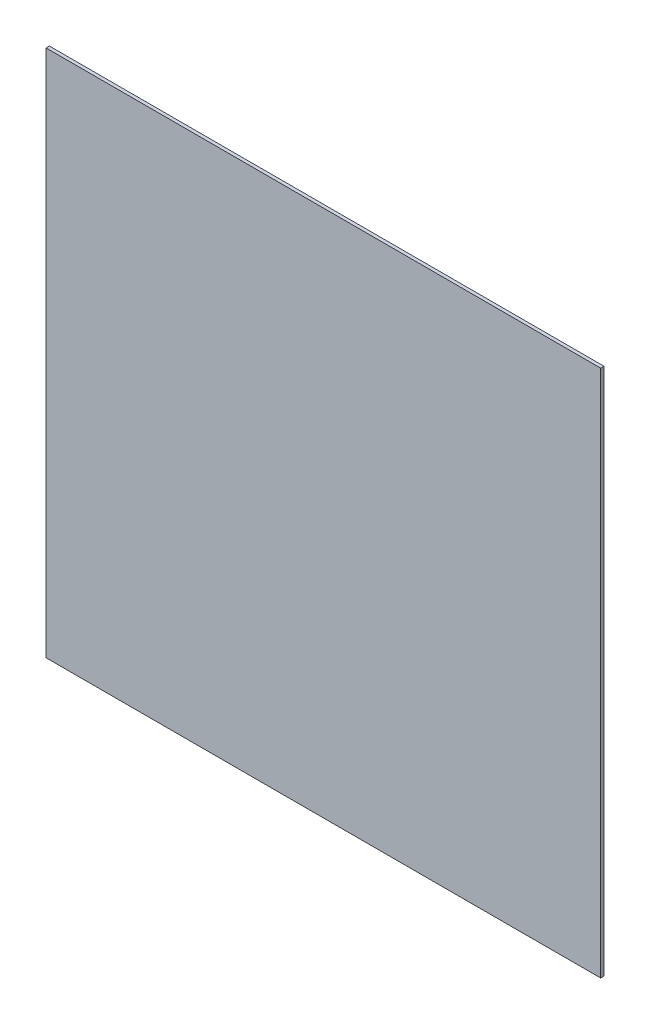
from build123d import *

# Parameters (mm, degrees)
CROQUIS1_W              = 533.4
CROQUIS1_H              = 508
SALIENTE_EXTRUIR1_DEPTH = 3.175


with BuildPart() as part:
    # Croquis1 → Saliente-Extruir1 (new body)
    with BuildSketch(Plane.XY):
        with Locations((266.7, 254)):
            Rectangle(CROQUIS1_W, CROQUIS1_H)
    extrude(amount=SALIENTE_EXTRUIR1_DEPTH)


solid = part.part
